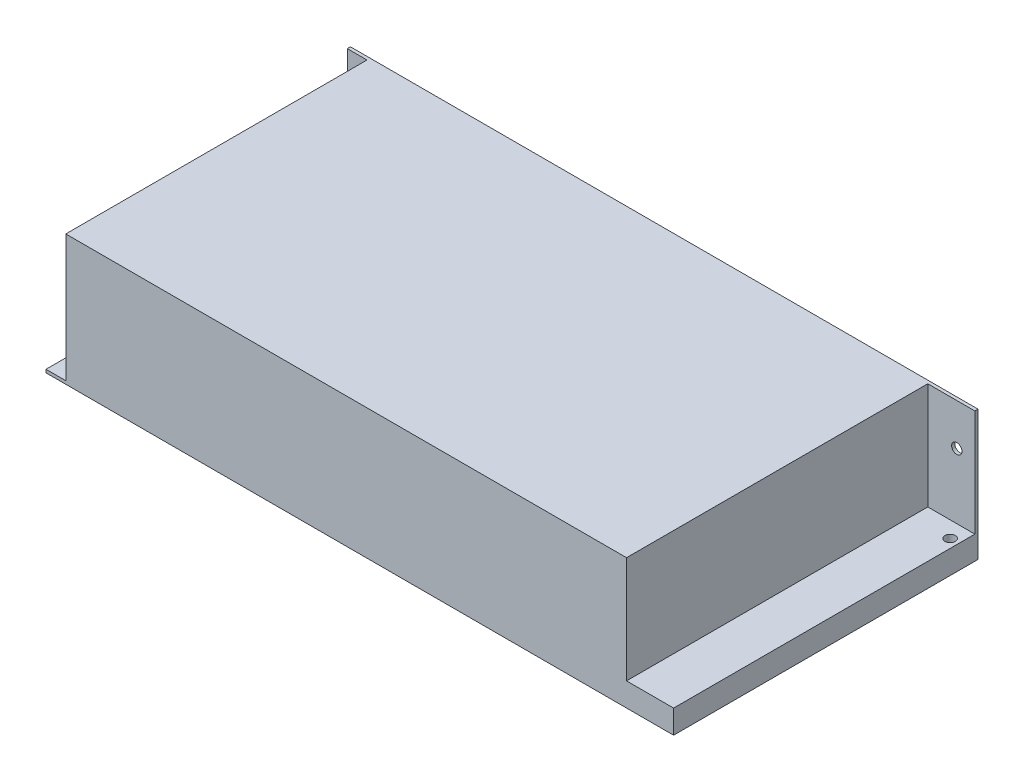
from build123d import *

# Parameters (mm, degrees)
SKETCH1_W           = 200
SKETCH1_H           = 97
BOSS_EXTRUDE1_DEPTH = 20.75
SKETCH2_W           = 15
SKETCH2_H           = 96
CUT_EXTRUDE1_DEPTH  = 34
SKETCH3_W           = 6.3
SKETCH3_H           = 96
CUT_EXTRUDE2_DEPTH  = 40.5
SKETCH4_R           = 1.65
CUT_EXTRUDE3_DEPTH  = 141.166195996
SKETCH5_R           = 1.65
CUT_EXTRUDE4_DEPTH  = 119.63599791


with BuildPart() as part:
    # Sketch1 → Boss-Extrude1 (new, symmetric)
    with BuildSketch(Plane(origin=(0, 0, 0), x_dir=(1, 0, 0), z_dir=(0, 1, 0))):
        Rectangle(SKETCH1_W, SKETCH1_H)
    extrude(amount=BOSS_EXTRUDE1_DEPTH, both=True)

    # Sketch2 → Cut-Extrude1 (cut)
    with BuildSketch(Plane(origin=(0, 20.75, 0), x_dir=(1, 0, 0), z_dir=(0, 1, 0))):
        with Locations((92.5, -0.5)):
            Rectangle(SKETCH2_W, SKETCH2_H)
    extrude(amount=-CUT_EXTRUDE1_DEPTH, mode=Mode.SUBTRACT)

    # Sketch3 → Cut-Extrude2 (cut)
    with BuildSketch(Plane(origin=(0, 20.75, 0), x_dir=(1, 0, 0), z_dir=(0, 1, 0))):
        with Locations((-96.85, -0.5)):
            Rectangle(SKETCH3_W, SKETCH3_H)
    extrude(amount=-CUT_EXTRUDE2_DEPTH, mode=Mode.SUBTRACT)

    # Sketch4 → Cut-Extrude3 (cut, through all)
    with BuildSketch(Plane.XY.offset(-47.5)):
        with Locations((94.25, 7.5)):
            Circle(SKETCH4_R)
        with BuildLine():
            Line((-96.35, 9.25), (-100, 9.25))
            Line((-100, 9.25), (-100, 5.95))
            Line((-100, 5.95), (-96.35, 5.95))
            ThreePointArc((-96.35, 5.95), (-94.7, 7.6), (-96.35, 9.25))
        make_face()
    extrude(amount=-CUT_EXTRUDE3_DEPTH, mode=Mode.SUBTRACT)

    # Sketch5 → Cut-Extrude4 (cut, through all)
    with BuildSketch(Plane.XZ.offset(20.75)):
        with Locations(Location((97.25, -42.35, 0), (0, 0, 270))):
            Circle(SKETCH5_R)
    extrude(amount=-CUT_EXTRUDE4_DEPTH, mode=Mode.SUBTRACT)


solid = part.part
